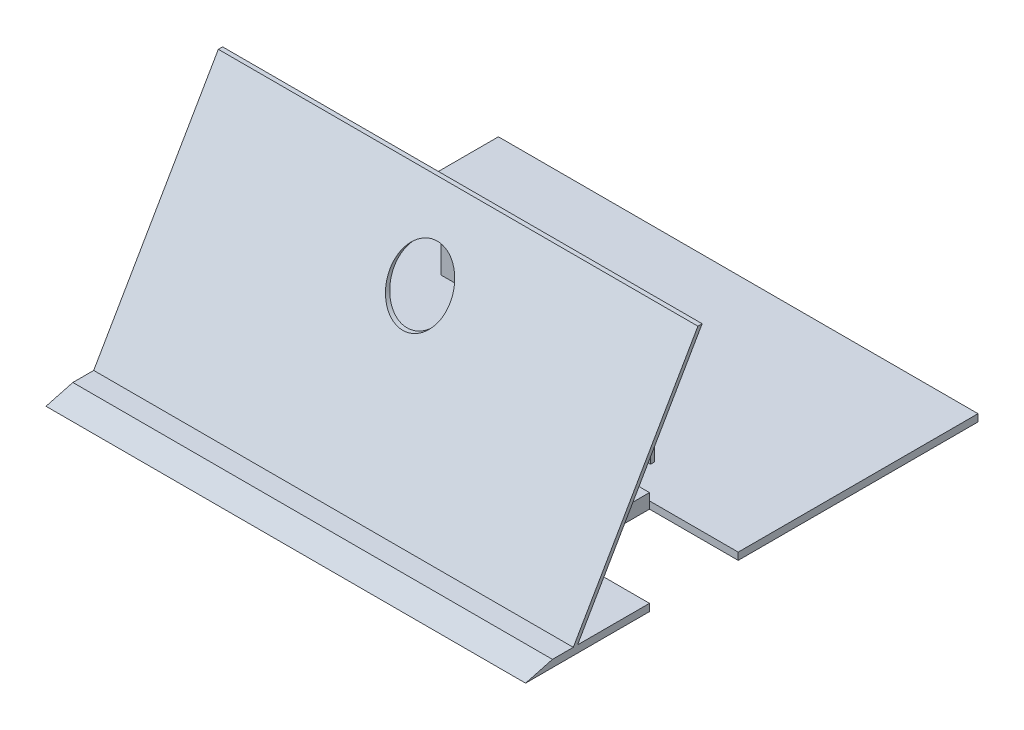
from build123d import *

# Parameters (mm, degrees)
SALIENTE_EXTRUIR2_DEPTH  = 100
SALIENTE_EXTRUIR3_DEPTH  = 200
CROQUIS11_W              = 37
CROQUIS11_H              = 37
CORTAR_EXTRUIR2_DEPTH    = 168.630546142
CROQUIS13_W              = 126.669935474
CROQUIS13_H              = 37
SALIENTE_EXTRUIR9_DEPTH  = 3
CROQUIS14_W              = 100
CROQUIS14_H              = 1.54
SALIENTE_EXTRUIR12_DEPTH = 50
SALIENTE_EXTRUIR13_REACH = 194.026
CROQUIS20_W              = 99.969357698
CROQUIS20_H              = 1.54
SALIENTE_EXTRUIR14_REACH = 152.336
CROQUIS21_W              = 100
CROQUIS21_H              = 1.54
CROQUIS22_W              = 25
CROQUIS22_H              = 1.45
SALIENTE_EXTRUIR15_DEPTH = 25
CROQUIS23_R              = 9.5
CORTAR_EXTRUIR9_DEPTH    = 1.45
CROQUIS24_R              = 12.5
CORTAR_EXTRUIR10_DEPTH   = 12.5


with BuildPart() as part:
    # Croquis5 → Saliente-Extruir2 (new, symmetric)
    with BuildSketch(Plane(origin=(0, 0, 0), x_dir=(0, 0, -1), z_dir=(1, 0, 0))):
        Polygon((-77.476042657, 3), (-88.67219508, 0), (100, 0), (100, 3), align=None)
    extrude(amount=SALIENTE_EXTRUIR2_DEPTH, both=True)

    # Croquis6 → Saliente-Extruir3 (add)
    with BuildSketch(Plane(origin=(100, 0, 0), x_dir=(0, 0, -1), z_dir=(1, 0, 0))):
        Polygon((-68.776042657, 3), (-16.81451843, 93), (-15.036279601, 93), (-66.997803828, 3), align=None)
    extrude(amount=-SALIENTE_EXTRUIR3_DEPTH)

    # Croquis11 → Cortar-Extruir2 (cut, through all)
    with BuildSketch(Plane(origin=(0, 3, 0), x_dir=(1, 0, 0), z_dir=(0, 1, 0))):
        with Locations((81.5, -18.5)):
            Rectangle(CROQUIS11_W, CROQUIS11_H)
        with Locations((-82.169935474, -18.5)):
            Rectangle(CROQUIS11_W, CROQUIS11_H)
    extrude(amount=-CORTAR_EXTRUIR2_DEPTH, mode=Mode.SUBTRACT)

    # Croquis13 → Saliente-Extruir9 (add)
    with BuildSketch(Plane(origin=(0, 3, 0), x_dir=(1, 0, 0), z_dir=(0, 1, 0))):
        with Locations((-0.334967737, -18.5)):
            Rectangle(CROQUIS13_W, CROQUIS13_H)
    extrude(amount=SALIENTE_EXTRUIR9_DEPTH)

    # Croquis20 → Saliente-Extruir13 (add, up to next)
    with BuildSketch(Plane.XY.offset(35), mode=Mode.PRIVATE) as saliente_extruir13_sk1:
        with Locations((0.015321151, 51.77)):
            Rectangle(CROQUIS20_W, CROQUIS20_H)
    saliente_extruir13_tool1 = extrude(saliente_extruir13_sk1.sketch, amount=SALIENTE_EXTRUIR13_REACH, mode=Mode.PRIVATE) - part.part


with BuildPart() as body_2:
    # Croquis14 → Saliente-Extruir12 (new body)
    with BuildSketch(Plane.XY.offset(35)):
        with Locations((0, 51.77)):
            Rectangle(CROQUIS14_W, CROQUIS14_H)
    extrude(amount=-SALIENTE_EXTRUIR12_DEPTH)


with BuildPart() as part_1:
    add(part.part)

    add(body_2.part)  # Saliente-Extruir13 merges body 2
    add(saliente_extruir13_tool1.solids().sort_by_distance((0.015321, 51.77, 35))[0])

    # Croquis21 → Saliente-Extruir14 (add, up to next)
    with BuildSketch(Plane.XZ.offset(-51), mode=Mode.PRIVATE) as saliente_extruir14_sk1:
        with Locations((0, -14.23)):
            Rectangle(CROQUIS21_W, CROQUIS21_H)
    saliente_extruir14_tool1 = extrude(saliente_extruir14_sk1.sketch, amount=SALIENTE_EXTRUIR14_REACH, mode=Mode.PRIVATE) - part_1.part
    add(saliente_extruir14_tool1.solids().sort_by_distance((0, 51, -14.23))[0])

    # Croquis22 → Saliente-Extruir15 (add)
    with BuildSketch(Plane(origin=(0, 52.54, 0), x_dir=(1, 0, 0), z_dir=(0, 1, 0))):
        with Locations((0, -10.725)):
            Rectangle(CROQUIS22_W, CROQUIS22_H)
    extrude(amount=SALIENTE_EXTRUIR15_DEPTH)

    # Croquis23 → Cortar-Extruir9 (cut)
    with BuildSketch(Plane(origin=(0, 0, 10), x_dir=(-1, 0, 0), z_dir=(0, 0, -1))):
        with Locations((0, 65.54)):
            Circle(CROQUIS23_R)
    extrude(amount=-CORTAR_EXTRUIR9_DEPTH, mode=Mode.SUBTRACT)

    # Croquis24 → Cortar-Extruir10 (cut, symmetric)
    with BuildSketch(Plane.XY.offset(35)):
        with Locations((0, 65.54)):
            Circle(CROQUIS24_R)
    extrude(amount=CORTAR_EXTRUIR10_DEPTH, both=True, mode=Mode.SUBTRACT)


solid = part_1.part
